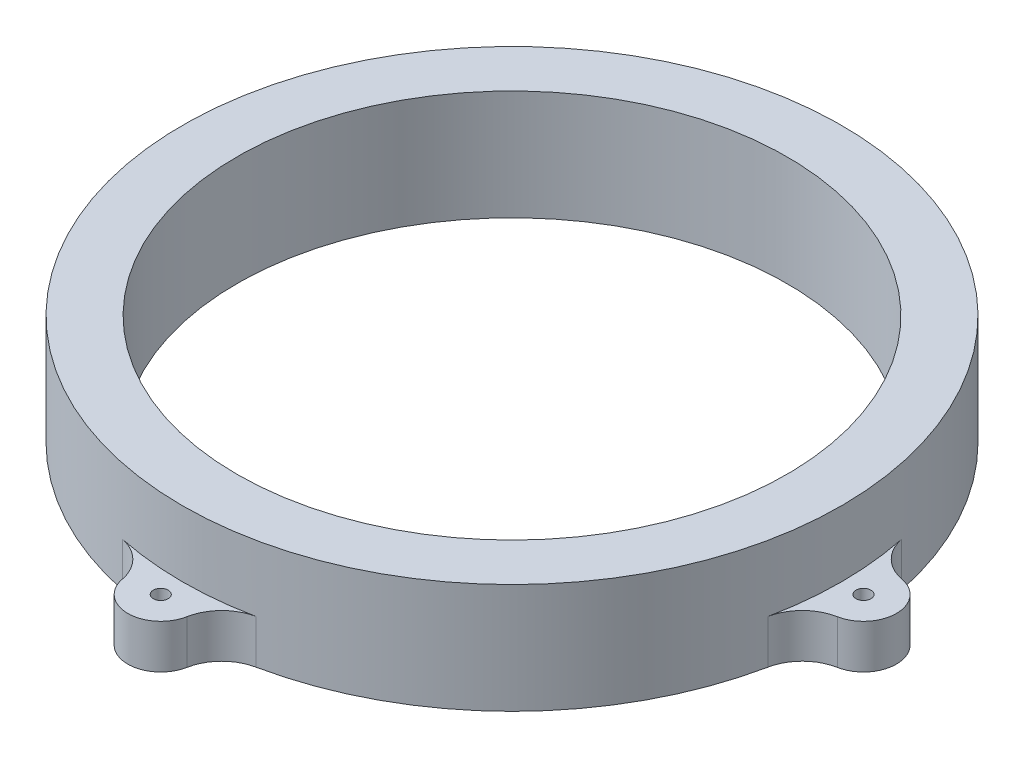
from build123d import *

# Parameters (mm, degrees)
SKETCH1_R           = 75
SKETCH1_R_2         = 62.6
SKETCH1_R_3         = 7.5
SKETCH1_R_4         = 1.7
BOSS_EXTRUDE1_DEPTH = 10
FILLET1_R           = 10
SKETCH2_R           = 75
SKETCH2_R_2         = 62.6
BOSS_EXTRUDE2_DEPTH = 15


with BuildPart() as part:
    # Sketch1 → Boss-Extrude1 (new body)
    # profile 1 of 5: a face of its own
    with BuildSketch(Plane(origin=(0, 0, 0), x_dir=(1, 0, 0), z_dir=(0, 1, 0))):
        Circle(SKETCH1_R)
        with Locations(Location((0, 0, 0), (0, 0, 270))):
            Circle(SKETCH1_R_2, mode=Mode.SUBTRACT)
    # profile 2 of 5: a face of its own
    with BuildSketch(Plane(origin=(0, 0, 0), x_dir=(1, 0, 0), z_dir=(0, 1, 0))):
        with Locations((0, 80)):
            Circle(SKETCH1_R_3)
        with Locations(Location((0, 80, 0), (0, 0, 270))):
            Circle(SKETCH1_R_4, mode=Mode.SUBTRACT)
    # profile 3 of 5: a face of its own
    with BuildSketch(Plane(origin=(0, 0, 0), x_dir=(1, 0, 0), z_dir=(0, 1, 0))):
        with Locations((79.975806452, 0.024193548)):
            Circle(SKETCH1_R_3)
        with Locations(Location((79.975806452, 0.024193548, 0), (0, 0, 270))):
            Circle(SKETCH1_R_4, mode=Mode.SUBTRACT)
    # profile 4 of 5: a face of its own
    with BuildSketch(Plane(origin=(0, 0, 0), x_dir=(1, 0, 0), z_dir=(0, 1, 0))):
        with Locations((0, -79.951612903)):
            Circle(SKETCH1_R_3)
        with Locations(Location((0, -79.951612903, 0), (0, 0, 270))):
            Circle(SKETCH1_R_4, mode=Mode.SUBTRACT)
    # profile 5 of 5: a face of its own
    with BuildSketch(Plane(origin=(0, 0, 0), x_dir=(1, 0, 0), z_dir=(0, 1, 0))):
        with Locations((-79.975806452, 0.024193548)):
            Circle(SKETCH1_R_3)
        with Locations(Location((-79.975806452, 0.024193548, 0), (0, 0, 270))):
            Circle(SKETCH1_R_4, mode=Mode.SUBTRACT)
    extrude(amount=BOSS_EXTRUDE1_DEPTH)

    # Fillet1
    fillet1_edges = [part.edges().sort_by_distance(p)[0] for p in [
        (-74.804759202, 5, 5.408142077),
        (-74.801473468, 5, -5.453399584),
        (5.452241155, 5, 74.801557914),
        (-5.452241155, 5, 74.801557914),
        (74.801473468, 5, -5.453399584),
        (74.804759202, 5, 5.408142077),
        (-5.409133759, 5, -74.8046875),
        (5.409133759, 5, -74.8046875),
    ]]
    fillet(fillet1_edges, radius=FILLET1_R)

    # Sketch2 → Boss-Extrude2 (add)
    with BuildSketch(Plane(origin=(0, 10, 0), x_dir=(1, 0, 0), z_dir=(0, 1, 0))):
        with Locations(Location((0, 0, 0), (0, 0, 78.327450214))):
            Circle(SKETCH2_R)
        with Locations(Location((0, 0, 0), (0, 0, 270))):
            Circle(SKETCH2_R_2, mode=Mode.SUBTRACT)
    extrude(amount=BOSS_EXTRUDE2_DEPTH)


solid = part.part
